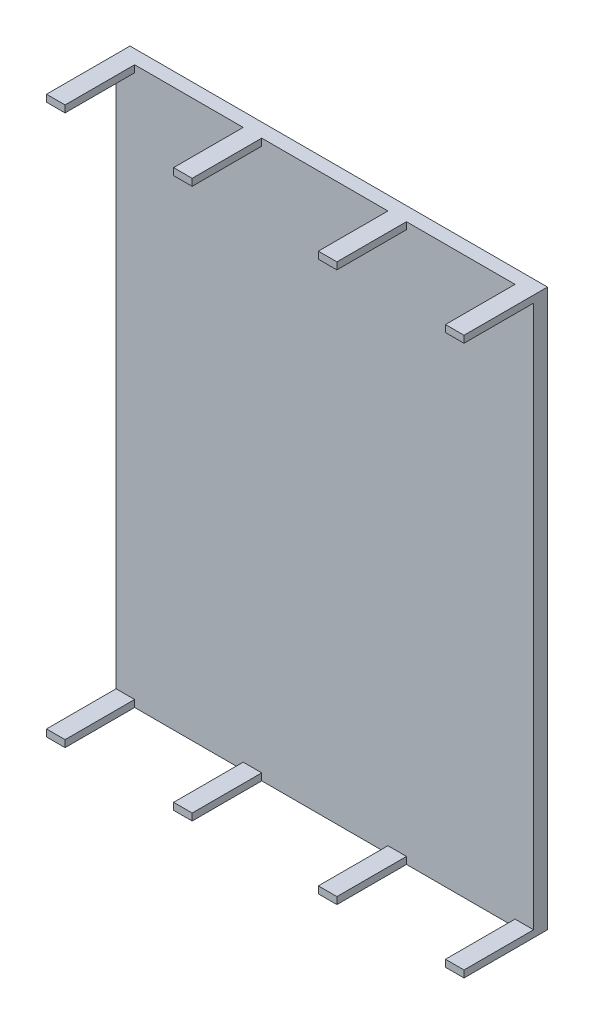
from build123d import *

# Parameters (mm, degrees)
SKETCH1_W           = 120
SKETCH1_H           = 90
BOSS_EXTRUDE1_DEPTH = 3
SKETCH2_W           = 4
SKETCH2_H           = 1.5
BOSS_EXTRUDE2_DEPTH = 15


with BuildPart() as part:
    # Sketch1 → Boss-Extrude1 (new body)
    with BuildSketch(Plane(origin=(0, 0, 0), x_dir=(0, 1, 0), z_dir=(0, 0, 1))):
        with Locations((-60, 45)):
            Rectangle(SKETCH1_W, SKETCH1_H)
    extrude(amount=BOSS_EXTRUDE1_DEPTH)

    # Sketch2 → Boss-Extrude2 (add)
    with BuildSketch(Plane.XY.offset(3)):
        with Locations((-88, -0.75)):
            Rectangle(SKETCH2_W, SKETCH2_H)
        with Locations((-60.6, -0.75)):
            Rectangle(SKETCH2_W, SKETCH2_H)
        with Locations((-29.4, -0.75)):
            Rectangle(SKETCH2_W, SKETCH2_H)
        with Locations((-2, -0.75)):
            Rectangle(SKETCH2_W, SKETCH2_H)
        with Locations((-88, -119.25)):
            Rectangle(SKETCH2_W, SKETCH2_H)
        with Locations((-60.6, -119.25)):
            Rectangle(SKETCH2_W, SKETCH2_H)
        with Locations((-29.4, -119.25)):
            Rectangle(SKETCH2_W, SKETCH2_H)
        with Locations((-2, -119.25)):
            Rectangle(SKETCH2_W, SKETCH2_H)
    extrude(amount=BOSS_EXTRUDE2_DEPTH)


solid = part.part
